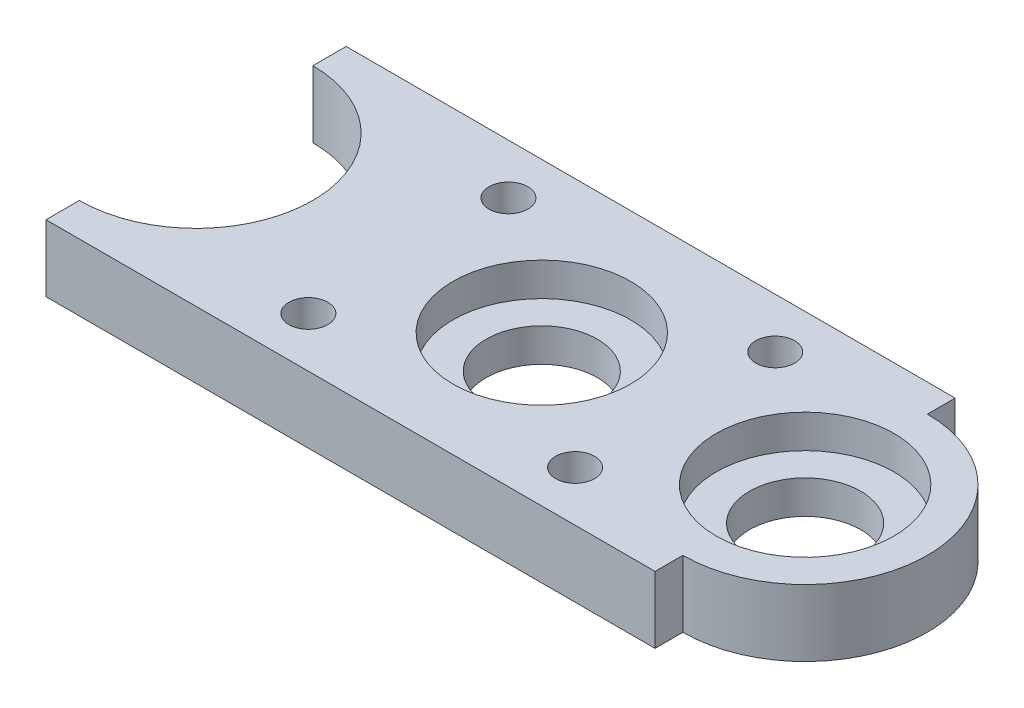
from build123d import *

# Parameters (mm, degrees)
SKETCH1_R           = 1.75
SKETCH1_R_2         = 5
BOSS_EXTRUDE1_DEPTH = 6
SKETCH2_R           = 3
SKETCH2_R_2         = 1.75
CUT_EXTRUDE1_DEPTH  = 3
CUT_EXTRUDE2_START  = -3
SKETCH3_R           = 8
SKETCH3_R_2         = 5
CUT_EXTRUDE2_DEPTH  = 3


with BuildPart() as part:
    # Sketch1 → Boss-Extrude1 (new body)
    with BuildSketch(Plane(origin=(0, 0, 0), x_dir=(1, 0, 0), z_dir=(0, 1, 0))):
        with BuildLine():
            Line((23.69, 13.5), (-31.1, 13.5))
            Line((-31.1, 13.5), (-31.1, 10.5))
            ThreePointArc((-31.1, 10.5), (-20.6, 0), (-31.1, -10.5))
            Line((-31.1, -10.5), (-31.1, -13.5))
            Line((-31.1, -13.5), (23.69, -13.5))
            Line((23.69, -13.5), (23.69, -11))
            ThreePointArc((23.69, -11), (34.69, 0), (23.69, 11))
            Line((23.69, 11), (23.69, 13.5))
        make_face()
        with Locations(Location((-12, -9, 0), (0, 0, 270))):
            Circle(SKETCH1_R, mode=Mode.SUBTRACT)
        with Locations(Location((12, -9, 0), (0, 0, 270))):
            Circle(SKETCH1_R, mode=Mode.SUBTRACT)
        with Locations(Location((-12, 9, 0), (0, 0, 270))):
            Circle(SKETCH1_R, mode=Mode.SUBTRACT)
        with Locations(Location((0, 0, 0), (0, 0, 270))):
            Circle(SKETCH1_R_2, mode=Mode.SUBTRACT)
        with Locations(Location((12, 9, 0), (0, 0, 270))):
            Circle(SKETCH1_R, mode=Mode.SUBTRACT)
        with Locations(Location((23.69, 0, 0), (0, 0, 270))):
            Circle(SKETCH1_R_2, mode=Mode.SUBTRACT)
    extrude(amount=BOSS_EXTRUDE1_DEPTH)

    # Sketch2 → Cut-Extrude1 (cut)
    # profile 1 of 4: a face of its own
    with BuildSketch(Plane.XZ):
        with Locations(Location((-12, -9, 0), (0, 0, 270))):
            Circle(SKETCH2_R)
        with Locations(Location((-12, -9, 0), (0, 0, 270))):
            Circle(SKETCH2_R_2, mode=Mode.SUBTRACT)
    # profile 2 of 4: a face of its own
    with BuildSketch(Plane.XZ):
        with Locations(Location((-12, 9, 0), (0, 0, 270))):
            Circle(SKETCH2_R)
        with Locations(Location((-12, 9, 0), (0, 0, 270))):
            Circle(SKETCH2_R_2, mode=Mode.SUBTRACT)
    # profile 3 of 4: a face of its own
    with BuildSketch(Plane.XZ):
        with Locations(Location((12, 9, 0), (0, 0, 270))):
            Circle(SKETCH2_R)
        with Locations(Location((12, 9, 0), (0, 0, 270))):
            Circle(SKETCH2_R_2, mode=Mode.SUBTRACT)
    # profile 4 of 4: a face of its own
    with BuildSketch(Plane.XZ):
        with Locations(Location((12, -9, 0), (0, 0, 270))):
            Circle(SKETCH2_R)
        with Locations(Location((12, -9, 0), (0, 0, 270))):
            Circle(SKETCH2_R_2, mode=Mode.SUBTRACT)
    extrude(amount=-CUT_EXTRUDE1_DEPTH, mode=Mode.SUBTRACT)

    # Sketch3 → Cut-Extrude2 (cut)
    # profile 1 of 2: a face of its own
    with BuildSketch(Plane(origin=(0, 6, 0), x_dir=(1, 0, 0), z_dir=(0, 1, 0)).offset(CUT_EXTRUDE2_START)):
        with Locations(Location((0, 0, 0), (0, 0, 270))):
            Circle(SKETCH3_R)
        with Locations(Location((0, 0, 0), (0, 0, 270))):
            Circle(SKETCH3_R_2, mode=Mode.SUBTRACT)
    # profile 2 of 2: a face of its own
    with BuildSketch(Plane(origin=(0, 6, 0), x_dir=(1, 0, 0), z_dir=(0, 1, 0)).offset(CUT_EXTRUDE2_START)):
        with Locations(Location((23.69, 0, 0), (0, 0, 270))):
            Circle(SKETCH3_R)
        with Locations(Location((23.69, 0, 0), (0, 0, 270))):
            Circle(SKETCH3_R_2, mode=Mode.SUBTRACT)
    extrude(amount=CUT_EXTRUDE2_DEPTH, mode=Mode.SUBTRACT)


solid = part.part
